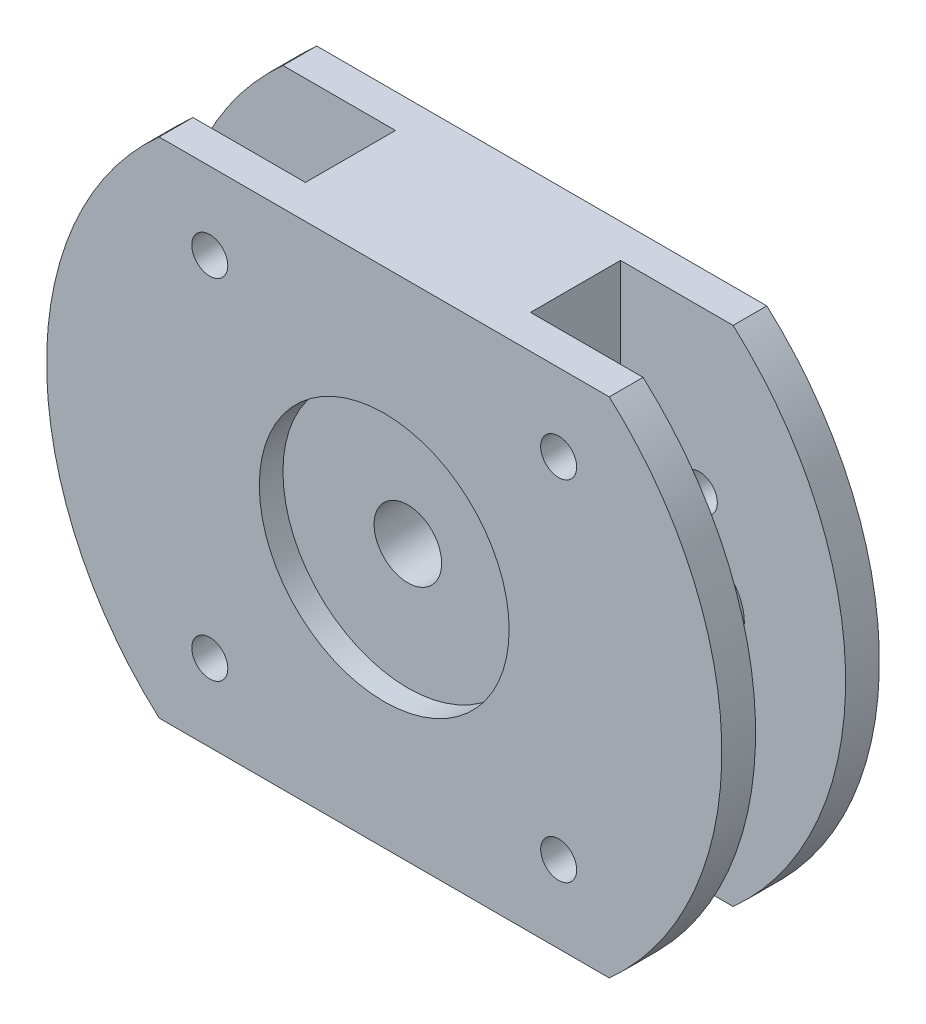
from build123d import *

# Parameters (mm, degrees)
EXTRUDE_1_DEPTH     = 3
SKETCH_2_R          = 1.6
SKETCH_2_R_2        = 2.55
CUT_EXTRUDE_1_DEPTH = 5
EXTRUDE_START       = 8
SKETCH_3_R          = 4
SKETCH_3_R_2        = 2.55
EXTRUDE_2_DEPTH     = 8
EXTRUDE_4_DEPTH     = 3
EXTRUDE_5_REACH     = 41
SKETCH_6_W          = 20
SKETCH_6_H          = 44.72135955
SKETCH_8_R          = 1.6
CUT_EXTRUDE_6_DEPTH = 10
SKETCH_9_R          = 3
CUT_EXTRUDE_7_DEPTH = 20
SKETCH_10_R         = 11.1
CUT_EXTRUDE_8_DEPTH = 2.1
SKETCH_11_R         = 5
SKETCH_11_R_2       = 3
EXTRUDE_6_DEPTH     = 2.4
FILLET_1_R          = 0.5
SKETCH_12_R         = 2.55
EXTRUDE_7_DEPTH     = 5


with BuildPart() as part:
    # 草图1 → 凸台-拉伸1 (new body)
    with BuildSketch(Plane.XY):
        with BuildLine():
            Line((-20, 22.360679775), (20, 22.360679775))
            ThreePointArc((20, 22.360679775), (30, 0), (20, -22.360679775))
            Line((20, -22.360679775), (-20, -22.360679775))
            ThreePointArc((-20, -22.360679775), (-30, 0), (-20, 22.360679775))
        make_face()
    extrude(amount=EXTRUDE_1_DEPTH)

    # 草图2 → 切除-拉伸1 (cut)
    with BuildSketch(Plane.XY.offset(3)):
        with Locations((17, 8)):
            Circle(SKETCH_2_R)
        with Locations((-17, 0)):
            Circle(SKETCH_2_R_2)
        with Locations((17, 0)):
            Circle(SKETCH_2_R_2)
        with Locations((17, -8)):
            Circle(SKETCH_2_R)
        with Locations((-17, -8)):
            Circle(SKETCH_2_R)
        with Locations((-17, 8)):
            Circle(SKETCH_2_R)
    extrude(amount=-CUT_EXTRUDE_1_DEPTH, mode=Mode.SUBTRACT)

    # 草图3 → 凸台-拉伸2 (add)
    # profile 1 of 2: a face of its own
    with BuildSketch(Plane.XY.offset(3).offset(EXTRUDE_START)):
        with Locations((17, 0)):
            Circle(SKETCH_3_R)
        with Locations((17, 0)):
            Circle(SKETCH_3_R_2, mode=Mode.SUBTRACT)
    # profile 2 of 2: a face of its own
    with BuildSketch(Plane.XY.offset(3).offset(EXTRUDE_START)):
        with Locations((-17, 0)):
            Circle(SKETCH_3_R)
        with Locations((-17, 0)):
            Circle(SKETCH_3_R_2, mode=Mode.SUBTRACT)
    extrude(amount=-EXTRUDE_2_DEPTH)

    # 草图5 → 凸台-拉伸4 (add)
    with BuildSketch(Plane.XY.offset(11)):
        with BuildLine():
            Line((-20, -22.360679775), (20, -22.360679775))
            ThreePointArc((20, -22.360679775), (30, 0), (20, 22.360679775))
            Line((20, 22.360679775), (-20, 22.360679775))
            ThreePointArc((-20, 22.360679775), (-30, 0), (-20, -22.360679775))
        make_face()
    extrude(amount=EXTRUDE_4_DEPTH)

    # 草图6 → 凸台-拉伸5 (add, up to next)
    with BuildSketch(Plane.XY.offset(3), mode=Mode.PRIVATE) as extrude_5_sk1:
        Rectangle(SKETCH_6_W, SKETCH_6_H)
    extrude_5_tool1 = extrude(extrude_5_sk1.sketch, amount=EXTRUDE_5_REACH, mode=Mode.PRIVATE) - part.part
    add(extrude_5_tool1.solids().sort_by_distance((0, 0, 3))[0])

    # 草图8 → 切除-拉伸6 (cut)
    with BuildSketch(Plane.XY.offset(14)):
        with Locations((15.5, 15.5)):
            Circle(SKETCH_8_R)
        with Locations((15.5, -15.5)):
            Circle(SKETCH_8_R)
        with Locations((-15.5, -15.5)):
            Circle(SKETCH_8_R)
        with Locations((-15.5, 15.5)):
            Circle(SKETCH_8_R)
    extrude(amount=-CUT_EXTRUDE_6_DEPTH, mode=Mode.SUBTRACT)

    # 草图9 → 切除-拉伸7 (cut)
    with BuildSketch(Plane.XY.offset(14)):
        Circle(SKETCH_9_R)
    extrude(amount=-CUT_EXTRUDE_7_DEPTH, mode=Mode.SUBTRACT)

    # 草图10 → 切除-拉伸8 (cut)
    with BuildSketch(Plane.XY.offset(14)):
        Circle(SKETCH_10_R)
    extrude(amount=-CUT_EXTRUDE_8_DEPTH, mode=Mode.SUBTRACT)

    # 草图11 → 凸台-拉伸6 (add)
    with BuildSketch(Plane(origin=(0, 0, 0), x_dir=(-1, 0, 0), z_dir=(0, 0, -1))):
        with Locations(Location((0, 0, 0), (0, 0, 180))):
            Circle(SKETCH_11_R)
        with Locations(Location((0, 0, 0), (0, 0, 180))):
            Circle(SKETCH_11_R_2, mode=Mode.SUBTRACT)
    extrude(amount=EXTRUDE_6_DEPTH)

    # 圆角1
    fillet_1_edges = [part.edges().sort_by_distance(p)[0] for p in [
        (-5, 0, 0),
        (-3, 0, -2.4),
        (-5, 0, -2.4),
    ]]
    fillet(fillet_1_edges, radius=FILLET_1_R)

    # 草图12 → 凸台-拉伸7 (add)
    with BuildSketch(Plane(origin=(0, 0, 11), x_dir=(-1, 0, 0), z_dir=(0, 0, -1))):
        with Locations(Location((-17, 0, 0), (0, 0, 180))):
            Circle(SKETCH_12_R)
        with Locations(Location((17, 0, 0), (0, 0, 180))):
            Circle(SKETCH_12_R)
    extrude(amount=EXTRUDE_7_DEPTH)


solid = part.part
